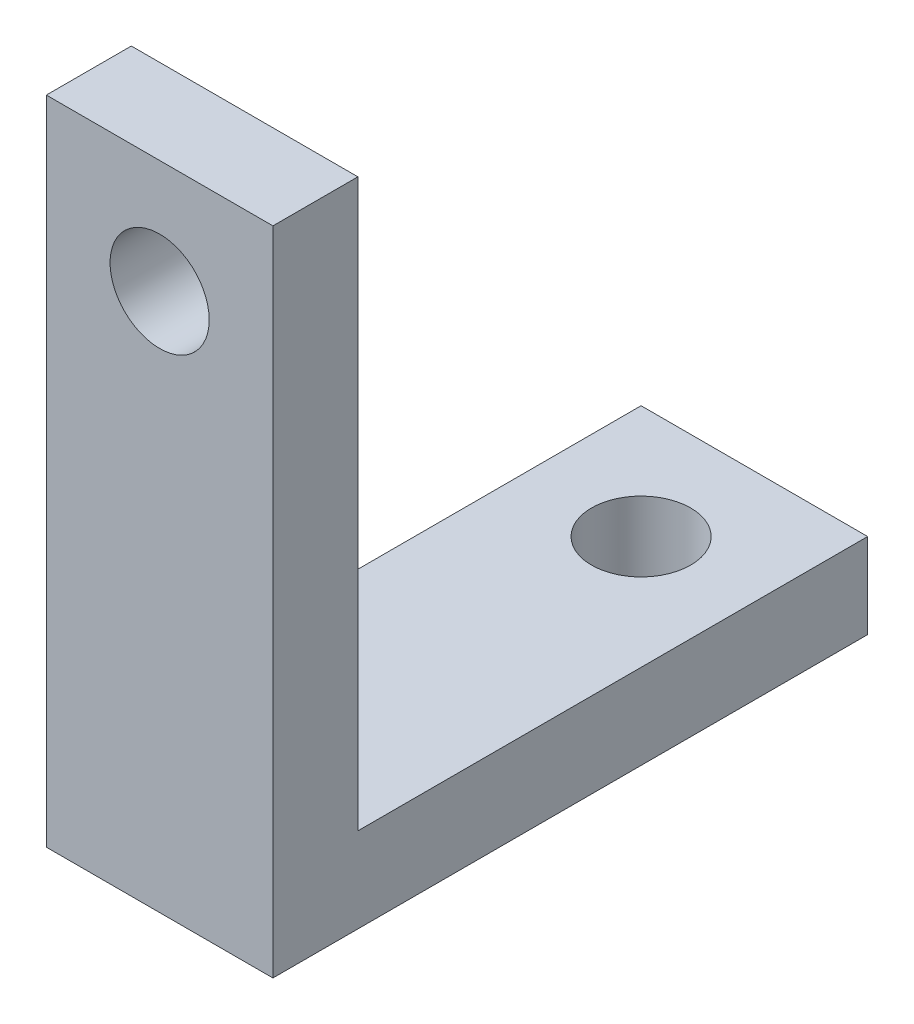
from build123d import *

# Parameters (mm, degrees)
SKETCH1_W           = 8
SKETCH1_H           = 23
BOSS_EXTRUDE1_DEPTH = 3
SKETCH2_W           = 8
SKETCH2_H           = 3
BOSS_EXTRUDE2_DEPTH = 18
SKETCH3_R           = 1.75
CUT_EXTRUDE1_DEPTH  = 8
SKETCH4_R           = 1.75
CUT_EXTRUDE2_DEPTH  = 8


with BuildPart() as part:
    # Sketch1 → Boss-Extrude1 (new body)
    with BuildSketch(Plane.XY):
        with Locations((-48.217529248, 5.656933129)):
            Rectangle(SKETCH1_W, SKETCH1_H)
    extrude(amount=BOSS_EXTRUDE1_DEPTH)

    # Sketch2 → Boss-Extrude2 (add)
    with BuildSketch(Plane(origin=(0, 0, 0), x_dir=(-1, 0, 0), z_dir=(0, 0, -1))):
        with Locations((48.217529248, -4.343066871)):
            Rectangle(SKETCH2_W, SKETCH2_H)
    extrude(amount=BOSS_EXTRUDE2_DEPTH)

    # Sketch3 → Cut-Extrude1 (cut)
    with BuildSketch(Plane(origin=(0, -5.843066871, 0), x_dir=(-1, 0, 0), z_dir=(0, -1, 0))):
        with Locations(Location((48.217529248, 14, 0), (0, 0, 90))):
            Circle(SKETCH3_R)
    extrude(amount=-CUT_EXTRUDE1_DEPTH, mode=Mode.SUBTRACT)

    # Sketch4 → Cut-Extrude2 (cut)
    with BuildSketch(Plane.XY.offset(3)):
        with Locations((-48.217529248, 13.156933129)):
            Circle(SKETCH4_R)
    extrude(amount=-CUT_EXTRUDE2_DEPTH, mode=Mode.SUBTRACT)


solid = part.part
